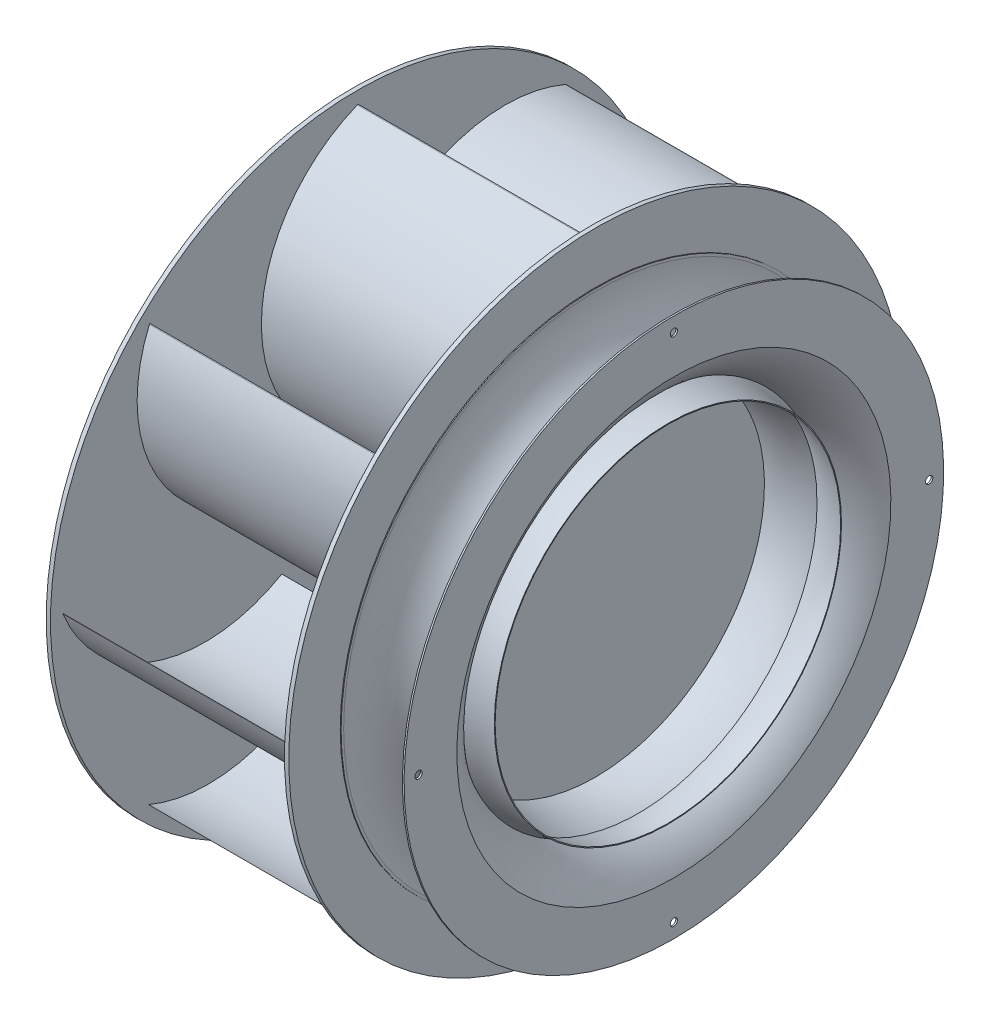
from build123d import *

# Parameters (mm, degrees)
SKETCH2_R         = 360.5
EXTRUDE1_DEPTH    = 5
SKETCH9_R         = 355.5
SKETCH9_R_2       = 100
EXTRUDE7_DEPTH    = 3
SKETCH3_R         = 360.5
EXTRUDE2_DEPTH    = 5
EXTRUDE3_DEPTH    = 280
CIRPATTERN1_COUNT = 8
SKETCH7_R         = 4.25
EXTRUDE5_DEPTH    = 5
CIRPATTERN2_COUNT = 4
SKETCH8_R         = 5
EXTRUDE6_DEPTH    = 90
CIRPATTERN3_COUNT = 8


with BuildPart() as part:
    # Sketch1 → Revolve1 (revolve)
    with BuildSketch(Plane.XY, mode=Mode.PRIVATE) as revolve1_sk:
        with BuildLine():
            Line((0, 0), (0, 109))
            ThreePointArc((0, 109), (1.464466094, 112.535533906), (5, 114))
            Line((5, 114), (70, 114))
            Line((70, 114), (70, 138))
            Line((70, 138), (90, 138))
            Line((90, 138), (90, 98))
            Line((90, 98), (92, 98))
            Line((92, 98), (92, 133))
            Line((92, 133), (95, 133))
            Line((95, 133), (95, 98))
            Line((95, 98), (97, 98))
            Line((97, 98), (97, 0))
            Line((97, 0), (0, 0))
        make_face()
    revolve(revolve1_sk.sketch.rotate(Axis((0, 0, 0), (1, 0, 0)), 90), axis=Axis((0, 0, 0), (1, 0, 0)))

    # Sketch2 → Extrude1 (add)
    with BuildSketch(Plane(origin=(97, 0, 0), x_dir=(0, 0, -1), z_dir=(1, 0, 0))):
        Circle(SKETCH2_R)
    extrude(amount=EXTRUDE1_DEPTH)

    # Sketch9 → Extrude7 (cut)
    with BuildSketch(Plane.ZY.offset(-97)):
        Circle(SKETCH9_R)
        Circle(SKETCH9_R_2, mode=Mode.SUBTRACT)
    extrude(amount=-EXTRUDE7_DEPTH, mode=Mode.SUBTRACT)



with BuildPart() as body_2:
    # Sketch3 → Extrude2 (new body)
    with BuildSketch(Plane(origin=(377, 0, 0), x_dir=(0, 0, -1), z_dir=(1, 0, 0))):
        Circle(SKETCH3_R)
    extrude(amount=EXTRUDE2_DEPTH)


with BuildPart() as part_1:
    add(part.part)

    add(body_2.part)  # Extrude3 merges body 2
    # Sketch4 → Extrude3 (add)
    with BuildSketch(Plane(origin=(102, 0, 0), x_dir=(0, 0, -1), z_dir=(1, 0, 0))):
        with BuildLine():
            Line((0, 125), (0.866025404, 124.5))
            ThreePointArc((0.866025404, 124.5), (95.805210607, 239.87865649), (245.171418304, 243.8053929))
            Line((245.171418304, 243.8053929), (244.3053929, 244.3053929))
            ThreePointArc((244.3053929, 244.3053929), (94.939185203, 240.37865649), (0, 125))
        make_face()
    extrude3 = extrude(amount=EXTRUDE3_DEPTH)

    # CirPattern1: Extrude3 ×8 about axis
    cirpattern1_axis = Axis((0, 0, 0), (1, 0, 0))
    for i in range(1, CIRPATTERN1_COUNT):
        add(extrude3.rotate(cirpattern1_axis, i * 360 / CIRPATTERN1_COUNT))

    # Sketch5 → Revolve2 (revolve)
    with BuildSketch(Plane.XY, mode=Mode.PRIVATE) as revolve2_sk:
        with BuildLine():
            Line((382, 300), (383, 300))
            Line((383, 300), (383, 297))
            ThreePointArc((383, 297), (404.543751848, 232.023388766), (467, 204))
            Line((467, 204), (467, 203))
            ThreePointArc((467, 203), (403.475614999, 230.988588031), (382, 297))
            Line((382, 297), (382, 300))
        make_face()
    revolve(revolve2_sk.sketch.rotate(Axis((0, 0, 0), (1, 0, 0)), 90), axis=Axis((0, 0, 0), (1, 0, 0)))

    # Sketch8 → Extrude6 (cut)
    with BuildSketch(Plane(origin=(0, 0, 0), x_dir=(0, 0, -1), z_dir=(1, 0, 0))):
        with Locations(Location((0, 126, 0), (0, 0, 180))):
            Circle(SKETCH8_R)
    extrude6 = extrude(amount=EXTRUDE6_DEPTH, mode=Mode.SUBTRACT)

    # CirPattern3: Extrude6 ×8 about axis
    cirpattern3_axis = Axis((0, 0, 0), (1, 0, 0))
    for i in range(1, CIRPATTERN3_COUNT):
        add(extrude6.rotate(cirpattern3_axis, i * 360 / CIRPATTERN3_COUNT), mode=Mode.SUBTRACT)


with BuildPart() as body_2_2:
    # Sketch6 → Revolve3 (revolve)
    with BuildSketch(Plane.XY, mode=Mode.PRIVATE) as revolve3_sk:
        with BuildLine():
            Line((474, 317), (472, 317))
            Line((472, 317), (472, 255))
            ThreePointArc((472, 255), (425.401338972, 209.999064886), (361, 203))
            Line((361, 203), (357, 203))
            Line((357, 203), (357, 201))
            Line((357, 201), (361, 201))
            ThreePointArc((361, 201), (427.000318465, 208.119703952), (474, 255))
            Line((474, 255), (474, 317))
        make_face()
    revolve(revolve3_sk.sketch.rotate(Axis((0, 0, 0), (1, 0, 0)), 180), axis=Axis((0, 0, 0), (1, 0, 0)))

    # Sketch7 → Extrude5 (cut)
    with BuildSketch(Plane(origin=(474, 0, 0), x_dir=(0, 0, -1), z_dir=(1, 0, 0))):
        with Locations((0, 300)):
            Circle(SKETCH7_R)
    extrude5 = extrude(amount=-EXTRUDE5_DEPTH, mode=Mode.SUBTRACT)

    # CirPattern2: Extrude5 ×4 about axis
    cirpattern2_axis = Axis((0, 0, 0), (1, 0, 0))
    for i in range(1, CIRPATTERN2_COUNT):
        add(extrude5.rotate(cirpattern2_axis, i * 360 / CIRPATTERN2_COUNT), mode=Mode.SUBTRACT)


solid = Compound([part_1.part, body_2_2.part])
